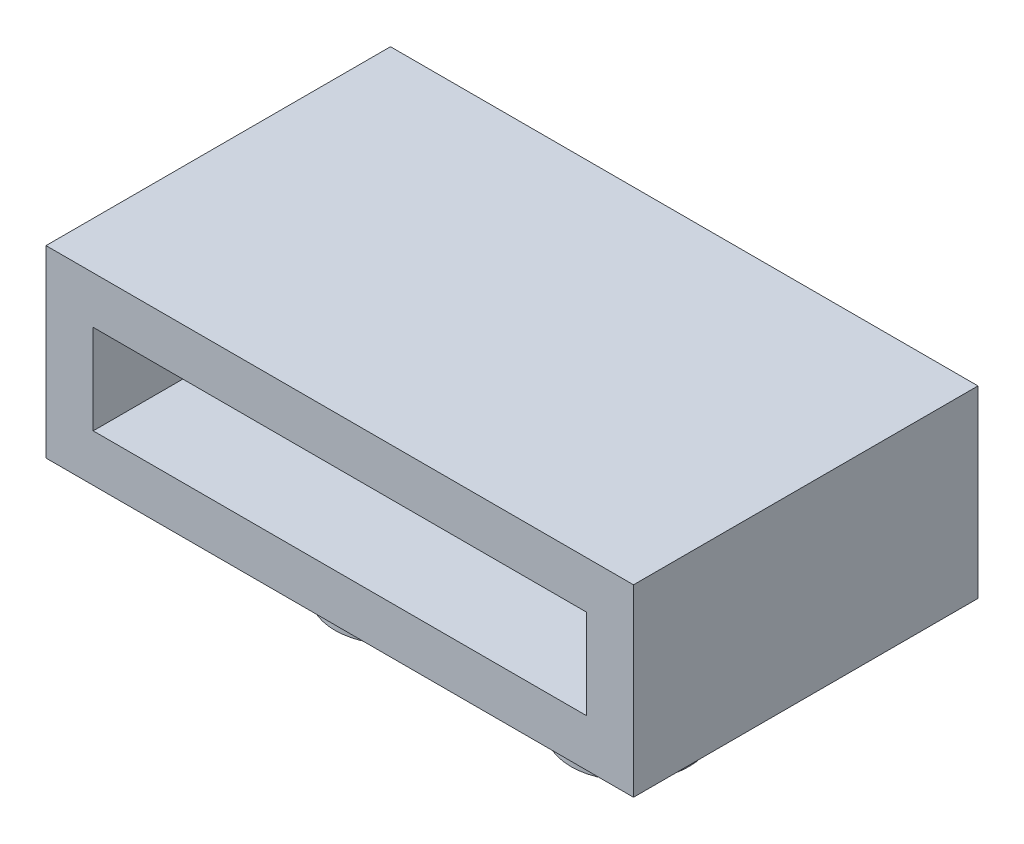
from build123d import *

# Parameters (mm, degrees)
BOSS_EXTRUDE1_DEPTH = 3.8
SKETCH1_3_W         = 24.9
SKETCH1_3_H         = 14.6
BOSS_EXTRUDE2_DEPTH = 2
SKETCH3_R           = 2.5
BOSS_EXTRUDE4_DEPTH = 5
SKETCH4_W           = 24.9
SKETCH4_H           = 14.6
BOSS_EXTRUDE5_DEPTH = 2


with BuildPart() as part:
    # Sketch1 → Boss-Extrude1 (new body)
    with BuildSketch(Plane(origin=(0, 0, 0), x_dir=(1, 0, 0), z_dir=(0, 1, 0))):
        Polygon((22.9, 14.6), (-2, 14.6), (-2, 0), (0, 0), (0, 12.6), (20.9, 12.6), (20.9, 0), (22.9, 0), align=None)
    extrude(amount=BOSS_EXTRUDE1_DEPTH)

    # Sketch1<3> → Boss-Extrude2 (add)
    with BuildSketch(Plane(origin=(0, 0, 0), x_dir=(1, 0, 0), z_dir=(0, 1, 0))):
        with Locations((10.45, 7.3)):
            Rectangle(SKETCH1_3_W, SKETCH1_3_H)
    extrude(amount=-BOSS_EXTRUDE2_DEPTH)

    # Sketch3 → Boss-Extrude4 (add)
    with BuildSketch(Plane.XZ.offset(2)):
        with Locations((5.45, -7.3)):
            Circle(SKETCH3_R)
        with Locations((15.45, -7.3)):
            Circle(SKETCH3_R)
    extrude(amount=BOSS_EXTRUDE4_DEPTH)

    # Sketch4 → Boss-Extrude5 (add)
    with BuildSketch(Plane(origin=(0, 3.8, 0), x_dir=(1, 0, 0), z_dir=(0, 1, 0))):
        with Locations((10.45, 7.3)):
            Rectangle(SKETCH4_W, SKETCH4_H)
    extrude(amount=BOSS_EXTRUDE5_DEPTH)


solid = part.part
